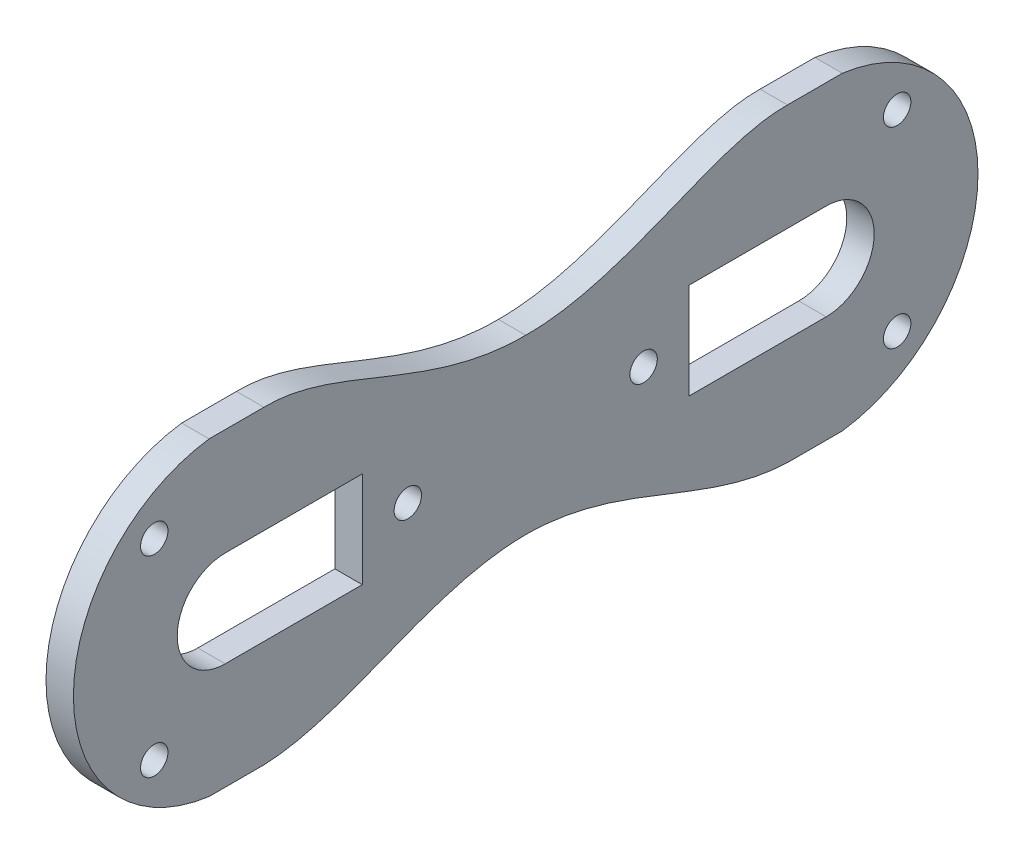
from build123d import *

# Parameters (mm, degrees)
SCHIZZO1_R                   = 1
ESTRUSIONE_ESTRUSIONE1_DEPTH = 2


with BuildPart() as part:
    # Schizzo1 → Estrusione-Estrusione1 (new body)
    with BuildSketch(Plane(origin=(0, 0, 0), x_dir=(0, 0, -1), z_dir=(1, 0, 0))):
        with BuildLine():
            Line((-2.501010101, -11.3), (1.498989899, -11.3))
            ThreePointArc((1.498989899, -11.3), (11.398989899, 0), (1.498989899, 11.3))
            Line((1.498989899, 11.3), (-2.501010101, 11.3))
            add(Edge.make_bspline(
                [(-2.501010101, 11.3), (-7.839898951, 11.429610053), (-14.35178918, 6.216652626), (-21.601010101, 6.3)],
                knots=[0, 0, 0, 0, 1, 1, 1, 1], degree=3))
            add(Edge.make_bspline(
                [(-40.701010101, 11.3), (-35.362121251, 11.429610053), (-28.850231022, 6.216652626), (-21.601010101, 6.3)],
                knots=[0, 0, 0, 0, 1, 1, 1, 1], degree=3))
            Line((-40.701010101, 11.3), (-44.701010101, 11.3))
            ThreePointArc((-44.701010101, 11.3), (-54.601010101, 0), (-44.701010101, -11.3))
            Line((-44.701010101, -11.3), (-40.701010101, -11.3))
            add(Edge.make_bspline(
                [(-40.701010101, -11.3), (-34.455779635, -11.063584615), (-28.769360616, -6.33994929), (-21.601010101, -6.3)],
                knots=[0, 0, 0, 0, 1, 1, 1, 1], degree=3))
            add(Edge.make_bspline(
                [(-2.501010101, -11.3), (-8.746240567, -11.063584615), (-14.432659586, -6.33994929), (-21.601010101, -6.3)],
                knots=[0, 0, 0, 0, 1, 1, 1, 1], degree=3))
        make_face()
        with Locations((-48.702020202, 7)):
            Circle(SCHIZZO1_R, mode=Mode.SUBTRACT)
        with Locations((-48.702020202, -7)):
            Circle(SCHIZZO1_R, mode=Mode.SUBTRACT)
        with Locations((-30.202020202, 0)):
            Circle(SCHIZZO1_R, mode=Mode.SUBTRACT)
        with Locations((-13, 0)):
            Circle(SCHIZZO1_R, mode=Mode.SUBTRACT)
        with Locations((5.5, 7)):
            Circle(SCHIZZO1_R, mode=Mode.SUBTRACT)
        with Locations((5.5, -7)):
            Circle(SCHIZZO1_R, mode=Mode.SUBTRACT)
        with BuildLine():
            Line((-9.676010101, 3.5), (0.323989899, 3.5))
            ThreePointArc((0.323989899, 3.5), (3.823989899, 0), (0.323989899, -3.5))
            Line((0.323989899, -3.5), (-9.676010101, -3.5))
            Line((-9.676010101, -3.5), (-9.676010101, 3.5))
        make_face(mode=Mode.SUBTRACT)
        with BuildLine():
            Line((-33.526010101, -3.5), (-43.526010101, -3.5))
            ThreePointArc((-43.526010101, -3.5), (-47.026010101, 0), (-43.526010101, 3.5))
            Line((-43.526010101, 3.5), (-33.526010101, 3.5))
            Line((-33.526010101, 3.5), (-33.526010101, -3.5))
        make_face(mode=Mode.SUBTRACT)
    extrude(amount=ESTRUSIONE_ESTRUSIONE1_DEPTH)


solid = part.part
